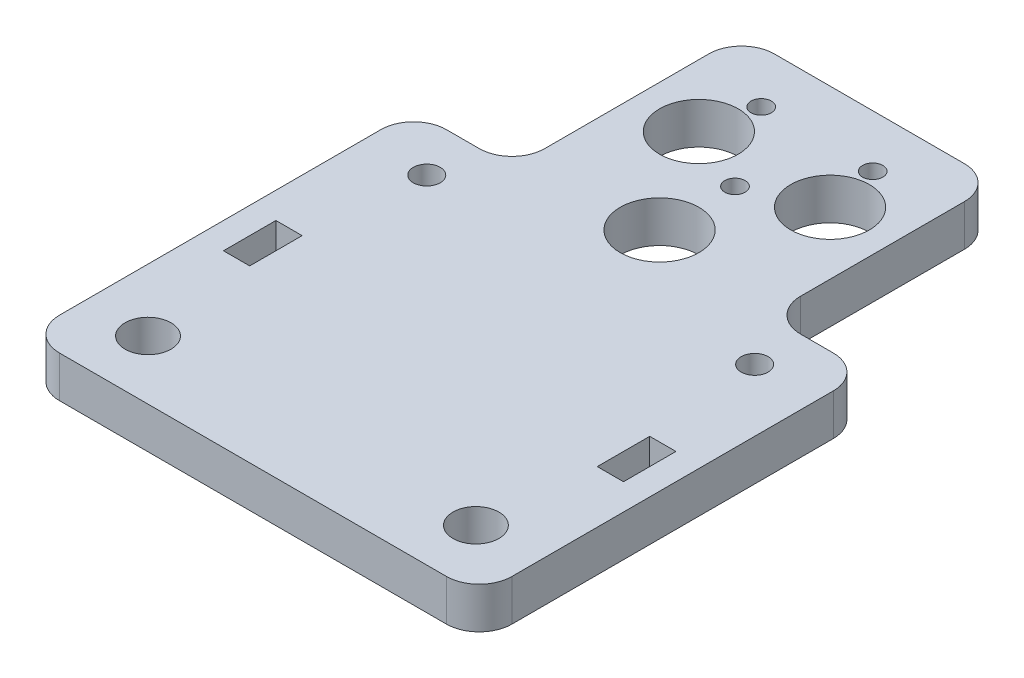
from build123d import *

# Parameters (mm, degrees)
SKETCH1_R           = 2.05
SKETCH1_R_2         = 3.5
SKETCH1_R_3         = 6
SKETCH1_R_4         = 1.55
SKETCH1_W           = 4
SKETCH1_H           = 8
BOSS_EXTRUDE1_DEPTH = 6.3
FILLET1_R           = 5


with BuildPart() as part:
    # Sketch1 → Boss-Extrude1 (new body)
    with BuildSketch(Plane(origin=(0, 0, 0), x_dir=(1, 0, 0), z_dir=(0, 1, 0))):
        Polygon((15, 94), (15, 59), (0, 59), (0, 0), (69, 0), (69, 59), (54, 59), (54, 94), align=None)
        with Locations(Location((9.5, 51.5, 0), (0, 0, 270))):
            Circle(SKETCH1_R, mode=Mode.SUBTRACT)
        with Locations(Location((59.5, 51.5, 0), (0, 0, 270))):
            Circle(SKETCH1_R, mode=Mode.SUBTRACT)
        with Locations(Location((9.5, 9, 0), (0, 0, 270))):
            Circle(SKETCH1_R_2, mode=Mode.SUBTRACT)
        with Locations(Location((59.5, 9, 0), (0, 0, 270))):
            Circle(SKETCH1_R_2, mode=Mode.SUBTRACT)
        with Locations(Location((24.5, 78, 0), (0, 0, 270))):
            Circle(SKETCH1_R_3, mode=Mode.SUBTRACT)
        with Locations(Location((44.5, 78, 0), (0, 0, 270))):
            Circle(SKETCH1_R_3, mode=Mode.SUBTRACT)
        with Locations(Location((34.5, 62, 0), (0, 0, 270))):
            Circle(SKETCH1_R_3, mode=Mode.SUBTRACT)
        with Locations(Location((34.5, 73.5, 0), (0, 0, 270))):
            Circle(SKETCH1_R_4, mode=Mode.SUBTRACT)
        with Locations(Location((26, 86, 0), (0, 0, 270))):
            Circle(SKETCH1_R_4, mode=Mode.SUBTRACT)
        with Locations(Location((43, 86, 0), (0, 0, 270))):
            Circle(SKETCH1_R_4, mode=Mode.SUBTRACT)
        with Locations((6, 30)):
            Rectangle(SKETCH1_W, SKETCH1_H, mode=Mode.SUBTRACT)
        with Locations((63, 30)):
            Rectangle(SKETCH1_W, SKETCH1_H, mode=Mode.SUBTRACT)
    extrude(amount=BOSS_EXTRUDE1_DEPTH)

    # Fillet1
    fillet1_edges = [part.edges().sort_by_distance(p)[0] for p in [
        (0, 3.15, -59),
        (15, 3.15, -59),
        (15, 3.15, -94),
        (54, 3.15, -94),
        (54, 3.15, -59),
        (69, 3.15, -59),
        (69, 3.15, 0),
        (0, 3.15, 0),
    ]]
    fillet(fillet1_edges, radius=FILLET1_R)


solid = part.part
